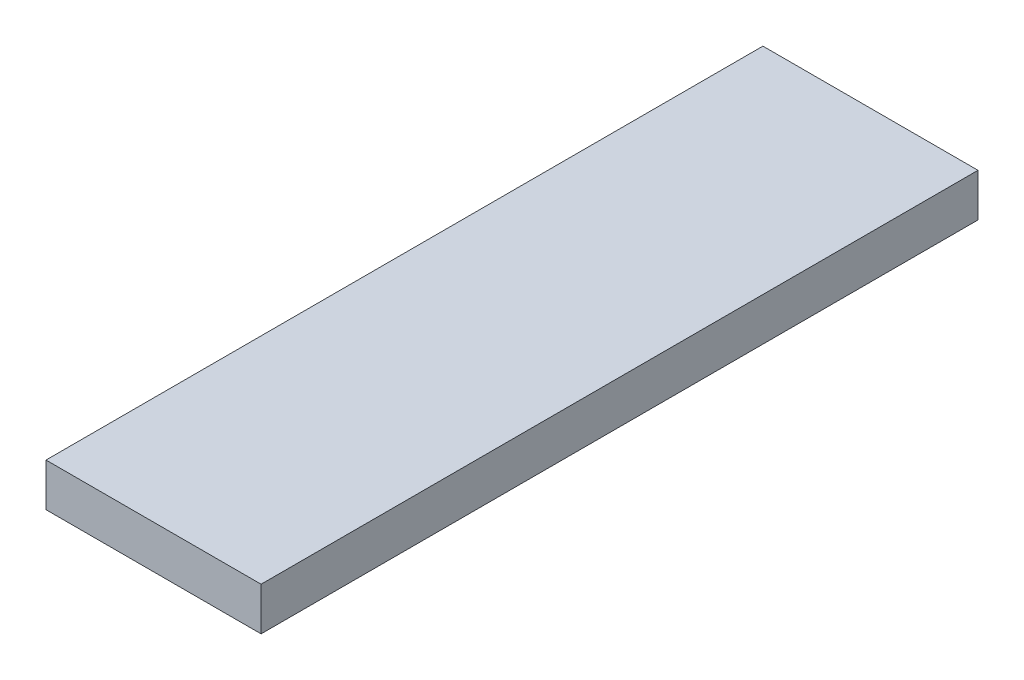
from build123d import *

# Parameters (mm, degrees)
SKETCH1_W           = 190.5
SKETCH1_H           = 38.1
BOSS_EXTRUDE1_DEPTH = 635


with BuildPart() as part:
    # Sketch1 → Boss-Extrude1 (new body)
    with BuildSketch(Plane.XY):
        with Locations((95.25, 19.05)):
            Rectangle(SKETCH1_W, SKETCH1_H)
    extrude(amount=BOSS_EXTRUDE1_DEPTH)


solid = part.part
